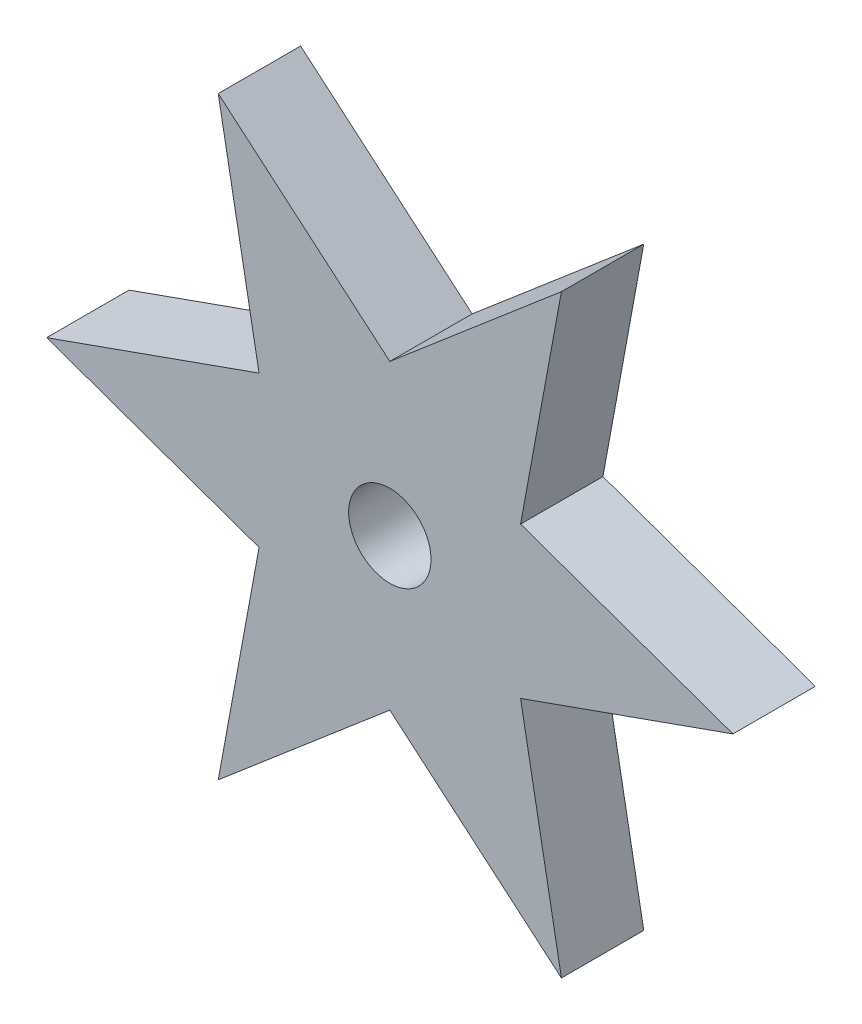
from build123d import *

# Parameters (mm, degrees)
SKETCH1_R           = 1.5
BOSS_EXTRUDE1_DEPTH = 3


with BuildPart() as part:
    # Sketch1 → Boss-Extrude1 (new body)
    with BuildSketch(Plane.XY):
        Polygon((12.5, 0), (4.763139721, 2.75), (6.25, 10.825317547), (0, 5.5), (-6.25, 10.825317547), (-4.763139721, 2.75), (-12.5, 0), (-4.763139721, -2.75), (-6.25, -10.825317547), (0, -5.5), (6.25, -10.825317547), (4.763139721, -2.75), align=None)
        Circle(SKETCH1_R, mode=Mode.SUBTRACT)
    extrude(amount=BOSS_EXTRUDE1_DEPTH)


solid = part.part
